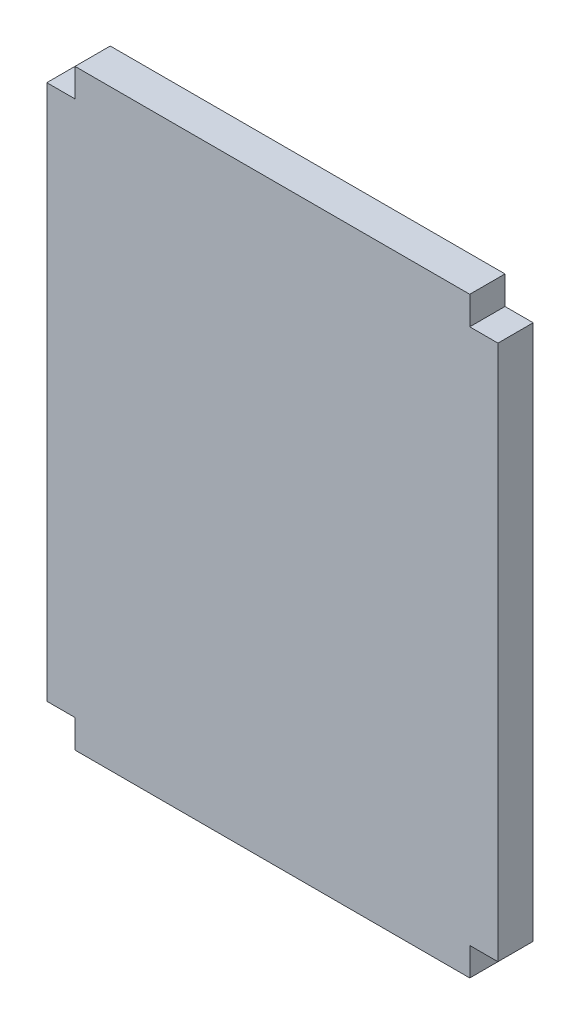
from build123d import *

# Parameters (mm, degrees)
SKETCH1_W           = 640
SKETCH1_H           = 840
BOSS_EXTRUDE1_DEPTH = 50
CUT_EXTRUDE1_REACH  = 1059.213
SKETCH2_W           = 40
SKETCH2_H           = 40


with BuildPart() as part:
    # Sketch1 → Boss-Extrude1 (new body)
    with BuildSketch(Plane.XY):
        with Locations((320, 420)):
            Rectangle(SKETCH1_W, SKETCH1_H)
    extrude(amount=BOSS_EXTRUDE1_DEPTH)

    # Sketch2 → Cut-Extrude1 (cut, up to next)
    with BuildSketch(Plane.XY.offset(50), mode=Mode.PRIVATE) as cut_extrude1_sk1:
        with Locations((20, 20)):
            Rectangle(SKETCH2_W, SKETCH2_H)
    cut_extrude1_tool1 = extrude(cut_extrude1_sk1.sketch, amount=-CUT_EXTRUDE1_REACH, mode=Mode.PRIVATE) & part.part
    # Sketch2 → Cut-Extrude1 (cut, up to next)
    with BuildSketch(Plane.XY.offset(50), mode=Mode.PRIVATE) as cut_extrude1_sk2:
        with Locations((620, 20)):
            Rectangle(SKETCH2_W, SKETCH2_H)
    cut_extrude1_tool2 = extrude(cut_extrude1_sk2.sketch, amount=-CUT_EXTRUDE1_REACH, mode=Mode.PRIVATE) & part.part
    # Sketch2 → Cut-Extrude1 (cut, up to next)
    with BuildSketch(Plane.XY.offset(50), mode=Mode.PRIVATE) as cut_extrude1_sk3:
        with Locations((620, 820)):
            Rectangle(SKETCH2_W, SKETCH2_H)
    cut_extrude1_tool3 = extrude(cut_extrude1_sk3.sketch, amount=-CUT_EXTRUDE1_REACH, mode=Mode.PRIVATE) & part.part
    # Sketch2 → Cut-Extrude1 (cut, up to next)
    with BuildSketch(Plane.XY.offset(50), mode=Mode.PRIVATE) as cut_extrude1_sk4:
        with Locations((20, 820)):
            Rectangle(SKETCH2_W, SKETCH2_H)
    cut_extrude1_tool4 = extrude(cut_extrude1_sk4.sketch, amount=-CUT_EXTRUDE1_REACH, mode=Mode.PRIVATE) & part.part
    add(cut_extrude1_tool1.solids().sort_by_distance((20, 20, 50))[0], mode=Mode.SUBTRACT)
    add(cut_extrude1_tool2.solids().sort_by_distance((620, 20, 50))[0], mode=Mode.SUBTRACT)
    add(cut_extrude1_tool3.solids().sort_by_distance((620, 820, 50))[0], mode=Mode.SUBTRACT)
    add(cut_extrude1_tool4.solids().sort_by_distance((20, 820, 50))[0], mode=Mode.SUBTRACT)


solid = part.part
